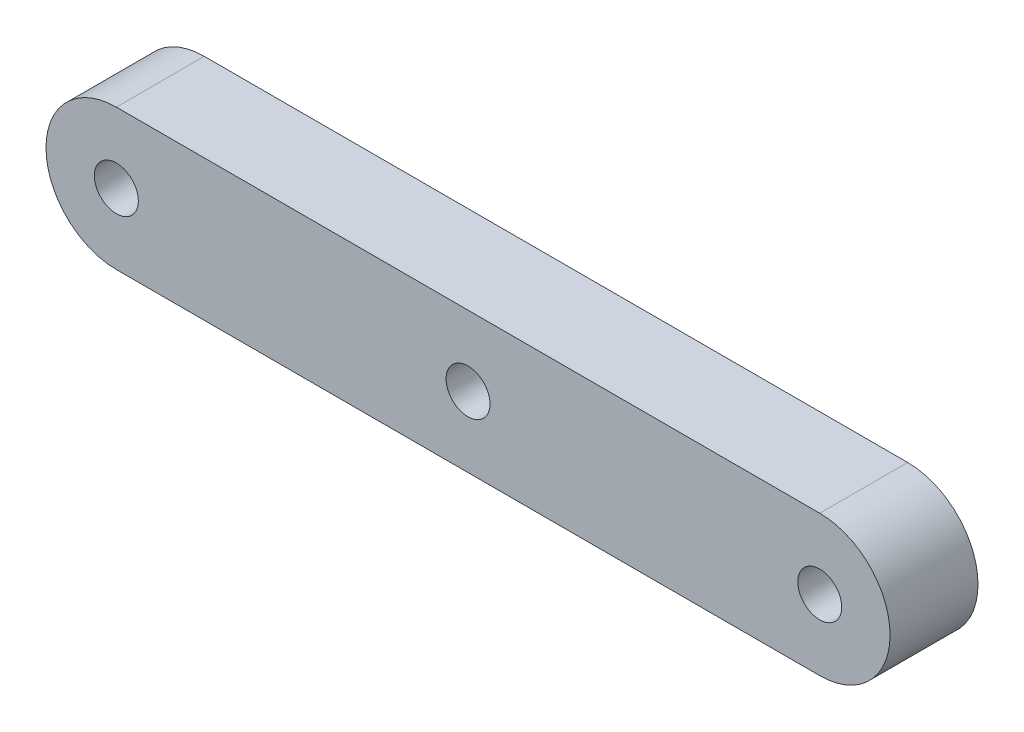
from build123d import *

# Parameters (mm, degrees)
SKETCH1_R           = 3.175
BOSS_EXTRUDE1_DEPTH = 12.7


with BuildPart() as part:
    # Sketch1 → Boss-Extrude1 (new body)
    with BuildSketch(Plane.XY):
        with BuildLine():
            Line((0.588618423, 69.00034483), (102.188618423, 69.00034483))
            ThreePointArc((102.188618423, 69.00034483), (112.348618423, 58.84034483), (102.188618423, 48.68034483))
            Line((102.188618423, 48.68034483), (0.588618423, 48.68034483))
            ThreePointArc((0.588618423, 48.68034483), (-9.571381577, 58.84034483), (0.588618423, 69.00034483))
        make_face()
        with Locations((51.388618423, 58.84034483)):
            Circle(SKETCH1_R, mode=Mode.SUBTRACT)
        with Locations((0.588618423, 58.84034483)):
            Circle(SKETCH1_R, mode=Mode.SUBTRACT)
        with Locations((102.188618423, 58.84034483)):
            Circle(SKETCH1_R, mode=Mode.SUBTRACT)
    extrude(amount=BOSS_EXTRUDE1_DEPTH)


solid = part.part
